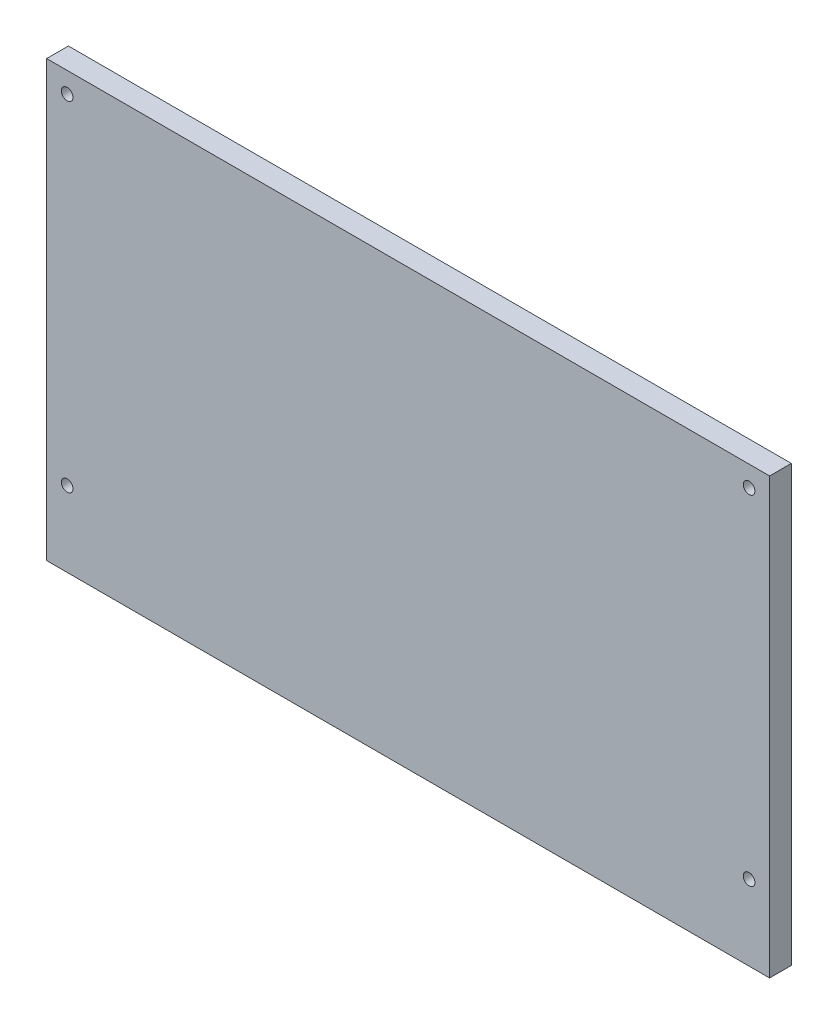
from build123d import *

# Parameters (mm, degrees)
SKETCH1_W            = 211.1756
SKETCH1_H            = 127
BOSS_EXTRUDE1_DEPTH  = 6.35
M3_CLEARANCE_HOLE1_D = 3.4


with BuildPart() as part:
    # Sketch1 → Boss-Extrude1 (new body)
    with BuildSketch(Plane.XY):
        with Locations((105.5878, 63.5)):
            Rectangle(SKETCH1_W, SKETCH1_H)
    extrude(amount=BOSS_EXTRUDE1_DEPTH)

    # M3 Clearance Hole1 (through all)
    with Locations(Plane.XY.offset(6.35)):
        with Locations((5.9944, 121.0056), (5.9944, 21.9964), (205.1812, 21.9964), (205.1812, 121.0056)):
            Hole(M3_CLEARANCE_HOLE1_D / 2)


solid = part.part
